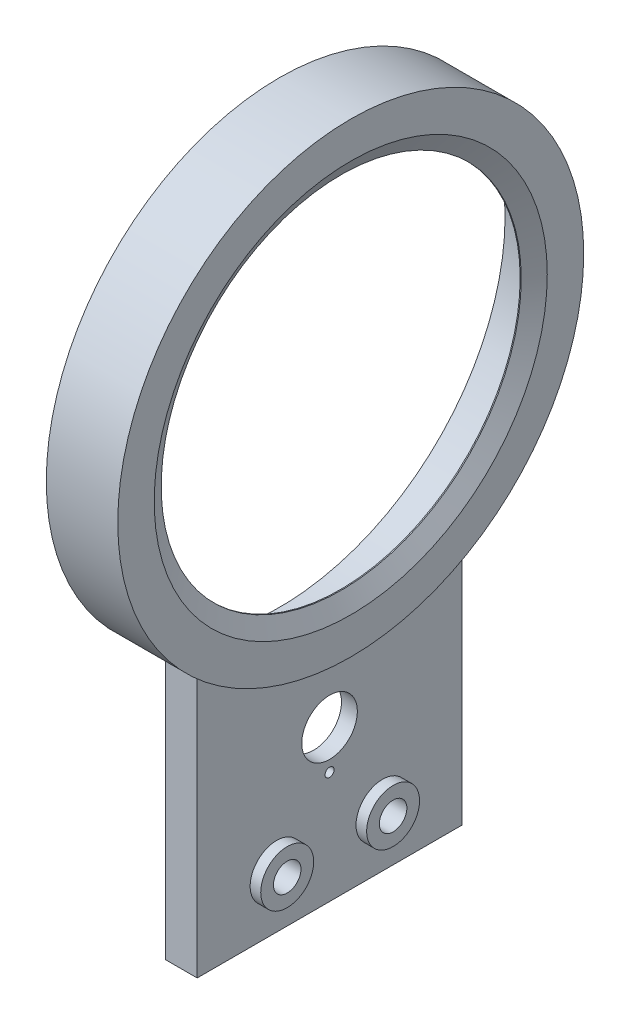
from build123d import *

# Parameters (mm, degrees)
SKETCH1_R           = 44
SKETCH1_R_2         = 42.65
BOSS_EXTRUDE1_DEPTH = 11.5
BOSS_EXTRUDE2_START = 2
SKETCH1_2_R         = 44
SKETCH1_2_R_2       = 34
BOSS_EXTRUDE2_DEPTH = 2
BOSS_EXTRUDE3_DEPTH = 6
SKETCH7_R           = 42.65
SKETCH7_R_2         = 39.5
BOSS_EXTRUDE4_DEPTH = 1
SKETCH8_R           = 5.25
SKETCH8_R_2         = 0.85
SKETCH8_R_3         = 2.6
CUT_EXTRUDE3_DEPTH  = 10
SKETCH9_R           = 12.5
CUT_EXTRUDE4_DEPTH  = 3
CHAMFER1_SIZE       = 1.8
CHAMFER1_SIZE2      = 3.117691454
BOSS_EXTRUDE5_START = -2
SKETCH11_R          = 5
SKETCH11_R_2        = 2.6
BOSS_EXTRUDE5_DEPTH = 2


with BuildPart() as part:
    # Sketch1 → Boss-Extrude1 (new body)
    with BuildSketch(Plane(origin=(0, 0, 0), x_dir=(0, 0, -1), z_dir=(1, 0, 0))):
        Circle(SKETCH1_R)
        Circle(SKETCH1_R_2, mode=Mode.SUBTRACT)
    extrude(amount=-BOSS_EXTRUDE1_DEPTH)

    # Sketch1<2> → Boss-Extrude2 (add)
    with BuildSketch(Plane(origin=(0, 0, 0), x_dir=(0, 0, -1), z_dir=(1, 0, 0)).offset(BOSS_EXTRUDE2_START)):
        Circle(SKETCH1_2_R)
        Circle(SKETCH1_2_R_2, mode=Mode.SUBTRACT)
    extrude(amount=-BOSS_EXTRUDE2_DEPTH)

    # Sketch5 → Boss-Extrude3 (add)
    with BuildSketch(Plane(origin=(-2, 0, 0), x_dir=(0, 0, -1), z_dir=(1, 0, 0))):
        with BuildLine():
            Line((-25, -36.20773398), (-25, -86))
            Line((-25, -86), (25, -86))
            Line((25, -86), (25, -36.20773398))
            ThreePointArc((25, -36.20773398), (0, -44), (-25, -36.20773398))
        make_face()
    extrude(amount=-BOSS_EXTRUDE3_DEPTH)

    # Sketch7 → Boss-Extrude4 (add)
    with BuildSketch(Plane.ZY):
        Circle(SKETCH7_R)
        Circle(SKETCH7_R_2, mode=Mode.SUBTRACT)
    extrude(amount=BOSS_EXTRUDE4_DEPTH)

    # Sketch8 → Cut-Extrude3 (cut)
    with BuildSketch(Plane(origin=(-2, 0, 0), x_dir=(0, 0, -1), z_dir=(1, 0, 0))):
        with Locations((0, -57.5)):
            Circle(SKETCH8_R)
        with Locations((0, -64.86)):
            Circle(SKETCH8_R_2)
        with Locations((-10, -76)):
            Circle(SKETCH8_R_3)
        with Locations((10, -76)):
            Circle(SKETCH8_R_3)
    extrude(amount=-CUT_EXTRUDE3_DEPTH, mode=Mode.SUBTRACT)

    # Sketch9 → Cut-Extrude4 (cut)
    with BuildSketch(Plane.ZY.offset(8)):
        with Locations((0, -57.5)):
            Circle(SKETCH9_R)
    extrude(amount=-CUT_EXTRUDE4_DEPTH, mode=Mode.SUBTRACT)

    # Chamfer1
    chamfer1_edges = [part.edges().sort_by_distance(p)[0] for p in [
        (2, 0, 34),
    ]]
    chamfer1_side = [part.faces().sort_by_distance(p)[0] for p in [
        (1, 0, 34),
    ]]
    chamfer(chamfer1_edges, length=CHAMFER1_SIZE, length2=CHAMFER1_SIZE2, reference=chamfer1_side[0])

    # Sketch11 → Boss-Extrude5 (add)
    # profile 1 of 2: a face of its own
    with BuildSketch(Plane.ZY.offset(2).offset(BOSS_EXTRUDE5_START)):
        with Locations((-10, -76)):
            Circle(SKETCH11_R)
        with Locations((-10, -76)):
            Circle(SKETCH11_R_2, mode=Mode.SUBTRACT)
    # profile 2 of 2: a face of its own
    with BuildSketch(Plane.ZY.offset(2).offset(BOSS_EXTRUDE5_START)):
        with Locations((10, -76)):
            Circle(SKETCH11_R)
        with Locations((10, -76)):
            Circle(SKETCH11_R_2, mode=Mode.SUBTRACT)
    extrude(amount=BOSS_EXTRUDE5_DEPTH)


solid = part.part
